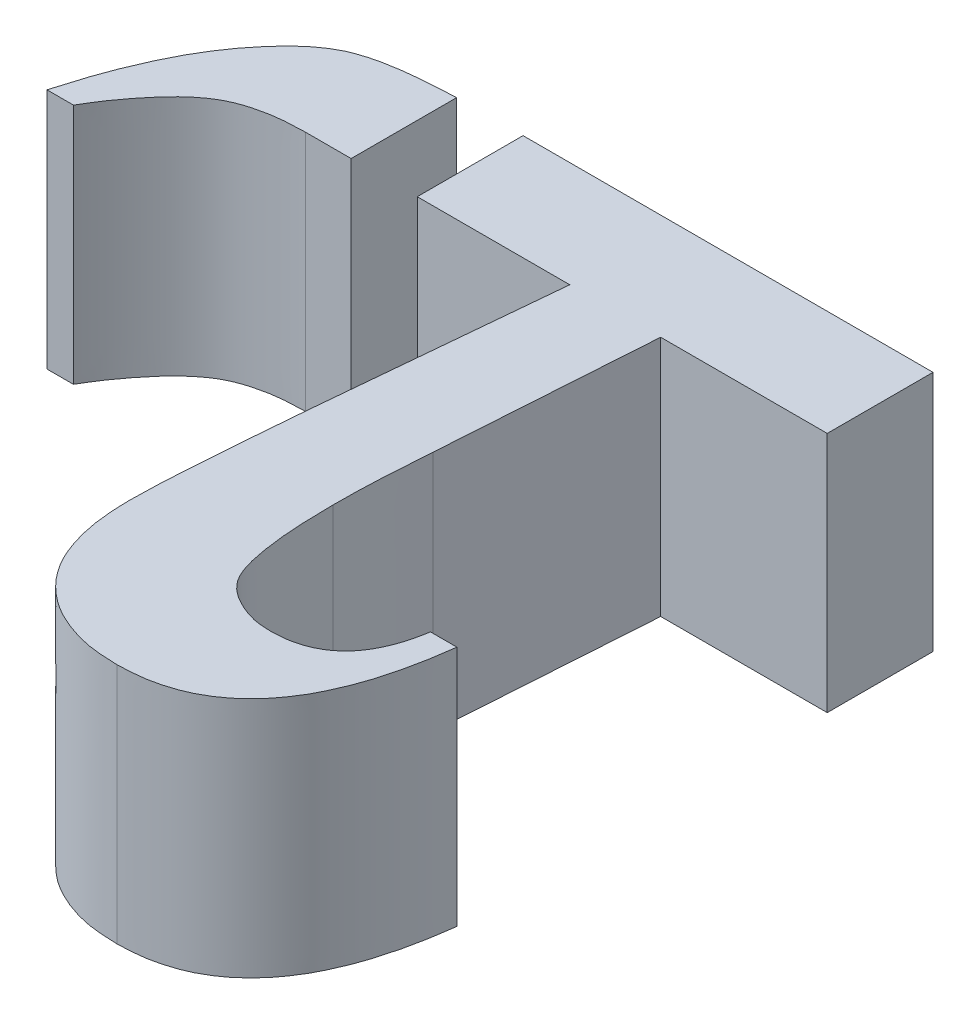
from build123d import *

# Parameters (mm, degrees)
BOSS_EXTRUDE1_DEPTH     = 12.7
CUT_EXTRUDE2_DEPTH      = 52.709076543
CUT_EXTRUDE2_DEPTH_BACK = 12.7


with BuildPart() as part:
    # Sketch2 → Boss-Extrude1 (new body)
    with BuildSketch(Plane(origin=(0, 0, 0), x_dir=(1, 0, 0), z_dir=(0, 1, 0))):
        with BuildLine():
            Line((36.805555556, 34.027777778), (36.805555556, 28.472222222))
            Line((36.805555556, 28.472222222), (28.059895833, 28.472222222))
            Line((28.059895833, 28.472222222), (27.311197917, 17.274305556))
            add(Edge.make_bspline(
                [(27.311197917, 17.274305556), (27.277795656, 16.804166639), (27.213581874, 15.900353642), (27.134284285, 14.591279231), (27.088344823, 13.379251723), (27.084956214, 12.601307574), (27.083333333, 12.228732639)],
                knots=[0, 0, 0, 0, 1.119532368, 2.152231754, 3.115062263, 4, 4, 4, 4], degree=3))
            add(Edge.make_bspline(
                [(27.083333333, 12.228732639), (27.088274581, 11.823604319), (27.097676522, 11.052747972), (27.1463749, 9.958919939), (27.245170271, 8.988755862), (27.371002693, 8.143926135), (27.529152233, 7.419430528), (27.728457334, 6.818301639), (27.97650636, 6.339464464), (28.352227221, 5.878445418), (28.902546694, 5.47047021), (29.612022333, 5.12581616), (30.381545964, 4.888099058), (30.919027092, 4.870283408), (31.195746528, 4.861111111)],
                knots=[0, 0, 0, 0, 1.508120221, 2.869569927, 4.073906796, 5.136392291, 6.047624064, 6.831039609, 7.487569696, 8.042672177, 9.031004047, 10.006413578, 10.97361213, 12, 12, 12, 12], degree=3))
            add(Edge.make_bspline(
                [(31.195746528, 4.861111111), (31.47916585, 4.872136088), (32.020929674, 4.893210634), (32.788220791, 5.094099051), (33.466107529, 5.423211567), (34.05259416, 5.891325855), (34.548953998, 6.488400226), (34.936220725, 7.22238631), (35.244986398, 8.076473761), (35.357486114, 8.699850181), (35.416666667, 9.027777778)],
                knots=[0, 0, 0, 0, 1.033647866, 1.975846305, 2.874029418, 3.767535477, 4.696297243, 5.689637366, 6.784632136, 8, 8, 8, 8], degree=3))
            Line((35.416666667, 9.027777778), (36.805555556, 9.027777778))
            add(Edge.make_bspline(
                [(36.805555556, 9.027777778), (36.751313392, 8.636593642), (36.645430641, 7.872987448), (36.430993277, 6.771079076), (36.1666915, 5.743505172), (35.873825885, 4.788096172), (35.503638642, 3.918308722), (35.126438428, 3.108890157), (34.67022236, 2.39005292), (34.190460036, 1.734735752), (33.64770155, 1.167708505), (33.078282467, 0.661363985), (32.447526517, 0.251271838), (31.785619175, -0.107880779), (31.064059185, -0.356214557), (30.308826122, -0.563500536), (29.502063403, -0.664205141), (28.949843487, -0.684214933), (28.667534722, -0.694444444)],
                knots=[0, 0, 0, 0, 1.346490984, 2.628401203, 3.824883511, 4.963792231, 6.031069444, 7.045970716, 8.004214277, 8.929182016, 9.810359102, 10.675861826, 11.520733207, 12.370272421, 13.236390006, 14.115839292, 15.03676947, 16, 16, 16, 16], degree=3))
            add(Edge.make_bspline(
                [(28.667534722, -0.694444444), (28.154682861, -0.675816782), (27.164131243, -0.639838242), (25.766335044, -0.242024901), (24.512145619, 0.369174112), (23.621609051, 1.101026149), (23.010255911, 1.797210882), (22.609852371, 2.383817061), (22.268478936, 3.030858971), (22.003101082, 3.740487332), (21.782965902, 4.501315843), (21.632459475, 5.322642072), (21.547875637, 6.204798769), (21.53462541, 6.814049436), (21.527777778, 7.12890625)],
                knots=[0, 0, 0, 0, 1.53176672, 2.958542455, 4.314758716, 5.68491526, 6.375705814, 7.084681483, 7.806528549, 8.560798466, 9.349284224, 10.175616502, 11.057170379, 12, 12, 12, 12], degree=3))
            add(Edge.make_bspline(
                [(21.527777778, 7.12890625), (21.530511411, 7.37125412), (21.536674087, 7.917600965), (21.569321673, 8.825873224), (21.639359606, 9.910585643), (21.725996598, 11.172904628), (21.834635018, 12.612456183), (21.96658957, 14.232690848), (22.114735136, 16.030968586), (22.235168036, 17.288909187), (22.298177083, 17.947048611)],
                knots=[0, 0, 0, 0, 0.536190643, 1.208783333, 2.010417809, 2.94084931, 4.00811323, 5.204264869, 6.537304937, 8, 8, 8, 8], degree=3))
            Line((22.298177083, 17.947048611), (23.285590278, 28.472222222))
            Line((23.285590278, 28.472222222), (15.277777778, 28.472222222))
            add(Edge.make_bspline(
                [(15.277777778, 28.472222222), (15.214460278, 27.401507925), (15.092072877, 25.331907254), (14.886109564, 22.340596723), (14.670777515, 19.573381685), (14.442846588, 17.030553937), (14.208342944, 14.71137929), (13.954506302, 12.617981517), (13.715610292, 10.74508508), (13.436521107, 9.086740026), (13.164846669, 7.602952782), (12.886850841, 6.270387957), (12.590238795, 5.07441313), (12.303899426, 4.011159992), (12.003972777, 3.085637953), (11.686744628, 2.301603715), (11.378814424, 1.642404725), (10.958043065, 0.964152103), (10.358101863, 0.292051075), (9.505081424, -0.285187523), (8.526340218, -0.641645855), (7.833640049, -0.676470824), (7.476128472, -0.694444444)],
                knots=[0, 0, 0, 0, 2.01044623, 3.886023449, 5.620111306, 7.212895615, 8.671360263, 9.989066837, 11.16552434, 12.209857215, 13.140654073, 13.99296191, 14.760845937, 15.449993852, 16.056713946, 16.582946555, 17.034739681, 17.418487115, 18.076100987, 18.706013306, 19.33215662, 20, 20, 20, 20], degree=3))
            add(Edge.make_bspline(
                [(7.476128472, -0.694444444), (7.207412809, -0.681627697), (6.681489385, -0.656543087), (5.927311086, -0.469815134), (5.234803565, -0.159026243), (4.623769653, 0.271526397), (4.10585267, 0.797998542), (3.737602188, 1.427988796), (3.515453468, 2.133829731), (3.486861324, 2.631486012), (3.472222222, 2.886284722)],
                knots=[0, 0, 0, 0, 1.073515936, 2.101057932, 3.084730514, 4.091615775, 5.073373561, 6.013242394, 6.982785322, 8, 8, 8, 8], degree=3))
            add(Edge.make_bspline(
                [(3.472222222, 2.886284722), (3.49977796, 3.167601475), (3.56174898, 3.800264126), (3.975195909, 4.785596558), (4.58793497, 5.912424554), (5.130000946, 6.671771181), (5.425347222, 7.085503472)],
                knots=[0, 0, 0, 0, 0.719350384, 1.617771125, 2.702035439, 4, 4, 4, 4], degree=3))
            add(Edge.make_bspline(
                [(5.425347222, 7.085503472), (5.880890291, 7.733268934), (6.778468477, 9.009592048), (7.924062056, 11.019134082), (8.912809694, 13.051591024), (9.583491505, 14.814505434), (10.052627408, 16.316401679), (10.355193153, 17.603017915), (10.666713374, 19.033013262), (10.926646603, 20.624922957), (11.194761694, 22.366552488), (11.410609585, 24.268277428), (11.637107009, 26.317618199), (11.748122743, 27.737606389), (11.805555556, 28.472222222)],
                knots=[0, 0, 0, 0, 1.256859471, 2.476450027, 3.668368903, 4.842737386, 5.467680022, 6.165560467, 6.940549266, 7.791280764, 8.726175375, 9.738470097, 10.830021485, 12, 12, 12, 12], degree=3))
            Line((11.805555556, 28.472222222), (9.407552083, 28.472222222))
            add(Edge.make_bspline(
                [(9.407552083, 28.472222222), (8.954085196, 28.460620671), (8.094301289, 28.438623856), (6.890732805, 28.196638527), (5.842130851, 27.81794011), (4.969568852, 27.229936528), (4.197964836, 26.514921386), (3.47646424, 25.663099106), (2.739413588, 24.704465568), (2.307624449, 23.984891132), (2.083333333, 23.611111111)],
                knots=[0, 0, 0, 0, 1.164670171, 2.208242094, 3.144640406, 4.011598175, 4.893941805, 5.843464191, 6.879796223, 8, 8, 8, 8], degree=3))
            Line((2.083333333, 23.611111111), (0.694444444, 23.611111111))
            add(Edge.make_bspline(
                [(0.694444444, 23.611111111), (0.877085401, 24.232597394), (1.229291, 25.431074191), (1.886266978, 27.119888333), (2.60411942, 28.642568556), (3.40397479, 29.980706486), (4.259111756, 31.115981615), (5.118517845, 32.058955597), (5.996672541, 32.785861584), (6.772590288, 33.224850634), (7.449074281, 33.455523285), (8.027104125, 33.619326955), (8.696031334, 33.743397524), (9.444623844, 33.855790163), (10.28602055, 33.921881494), (11.211287579, 33.993942488), (12.22496831, 34.020966417), (12.926797761, 34.025446099), (13.292100694, 34.027777778)],
                knots=[0, 0, 0, 0, 1.702237036, 3.282601159, 4.758360036, 6.123233304, 7.372634412, 8.489452943, 9.469553166, 10.358928799, 10.813046741, 11.345939706, 11.937066667, 12.599998432, 13.335161994, 14.154869419, 15.039607681, 16, 16, 16, 16], degree=3))
            Line((13.292100694, 34.027777778), (36.805555556, 34.027777778))
        make_face()
    extrude(amount=BOSS_EXTRUDE1_DEPTH)

    # Sketch3 → Cut-Extrude2 (cut, two sides: drawn at the far end of the back side and taken through both)
    with BuildSketch(Plane(origin=(0, 12.7, 0), x_dir=(1, 0, 0), z_dir=(0, 1, 0)).offset(-CUT_EXTRUDE2_DEPTH_BACK)):
        with BuildLine():
            Line((11.805555556, 28.472222222), (15.277777778, 28.472222222))
            add(Edge.make_bspline(
                [(7.476128472, -0.694444444), (7.833640049, -0.676470824), (8.526340218, -0.641645855), (9.505081424, -0.285187523), (10.358101863, 0.292051075), (10.958043065, 0.964152103), (11.378814424, 1.642404725), (11.686744628, 2.301603715), (12.003972777, 3.085637953), (12.303899426, 4.011159992), (12.590238795, 5.07441313), (12.886850841, 6.270387957), (13.164846669, 7.602952782), (13.436521107, 9.086740026), (13.715610292, 10.74508508), (13.954506302, 12.617981517), (14.208342944, 14.71137929), (14.442846588, 17.030553937), (14.670777515, 19.573381685), (14.886109564, 22.340596723), (15.092072877, 25.331907254), (15.214460278, 27.401507925), (15.277777778, 28.472222222)],
                knots=[0, 0, 0, 0, 0.033392169, 0.064699335, 0.096194951, 0.129075644, 0.148263016, 0.170852672, 0.197164303, 0.227500307, 0.261957703, 0.300351905, 0.342967296, 0.389507139, 0.441723783, 0.500546658, 0.566431987, 0.639355219, 0.718994435, 0.805698828, 0.899477689, 1, 1, 1, 1], degree=3))
            add(Edge.make_bspline(
                [(3.472222222, 2.886284722), (3.486861324, 2.631486012), (3.515453468, 2.133829731), (3.737602188, 1.427988796), (4.10585267, 0.797998542), (4.623769653, 0.271526397), (5.234803565, -0.159026243), (5.927311086, -0.469815134), (6.681489385, -0.656543087), (7.207412809, -0.681627697), (7.476128472, -0.694444444)],
                knots=[0, 0, 0, 0, 0.127151835, 0.248344701, 0.365828305, 0.488548028, 0.614408686, 0.737367758, 0.865810508, 1, 1, 1, 1], degree=3))
            add(Edge.make_bspline(
                [(5.425347222, 7.085503472), (5.130000946, 6.671771181), (4.58793497, 5.912424554), (3.975195909, 4.785596558), (3.56174898, 3.800264126), (3.49977796, 3.167601475), (3.472222222, 2.886284722)],
                knots=[0, 0, 0, 0, 0.32449114, 0.595557219, 0.820162404, 1, 1, 1, 1], degree=3))
            add(Edge.make_bspline(
                [(11.805555556, 28.472222222), (11.748122743, 27.737606389), (11.637107009, 26.317618199), (11.410609585, 24.268277428), (11.194761694, 22.366552488), (10.926646603, 20.624922957), (10.666713374, 19.033013262), (10.355193153, 17.603017915), (10.052627408, 16.316401679), (9.583491505, 14.814505434), (8.912809694, 13.051591024), (7.924062056, 11.019134082), (6.778468477, 9.009592048), (5.880890291, 7.733268934), (5.425347222, 7.085503472)],
                knots=[0, 0, 0, 0, 0.09749821, 0.188460825, 0.272818719, 0.350726603, 0.421620894, 0.486203294, 0.544359998, 0.596438551, 0.694302591, 0.793629164, 0.895261711, 1, 1, 1, 1], degree=3))
        make_face()
        with BuildLine():
            Line((11.805555556, 34.00851445), (11.805555556, 28.472222222))
            Line((11.805555556, 28.472222222), (15.277777778, 28.472222222))
            Line((15.277777778, 28.472222222), (15.277777778, 34.027777778))
            Line((15.277777778, 34.027777778), (13.292100694, 34.027777778))
            add(Edge.make_bspline(
                [(13.292100694, 34.027777778), (12.926797761, 34.025446099), (12.431281834, 34.022283288), (11.935745047, 34.012026213), (11.805555556, 34.00851445)],
                knots=[0, 0, 0, 0, 0.06002452, 0.081420385, 0.081420385, 0.081420385, 0.081420385], degree=3))
        make_face()
    extrude(amount=CUT_EXTRUDE2_DEPTH + CUT_EXTRUDE2_DEPTH_BACK, mode=Mode.SUBTRACT)


with BuildPart() as cut_extrude2_piece_1:
    # of the separate pieces the step leaves, piece 1, a body of its own (cut_extrude2_pieces)
    add(part.part.solids().sort_by_distance((36.805555556, 0, -34.027777778))[0])


with BuildPart() as cut_extrude2_piece_2:
    # of the separate pieces the step leaves, piece 2, a body of its own (cut_extrude2_pieces)
    add(part.part.solids().sort_by_distance((0.694444444, 0, -23.611111111))[0])


solid = Compound([cut_extrude2_piece_1.part, cut_extrude2_piece_2.part])
